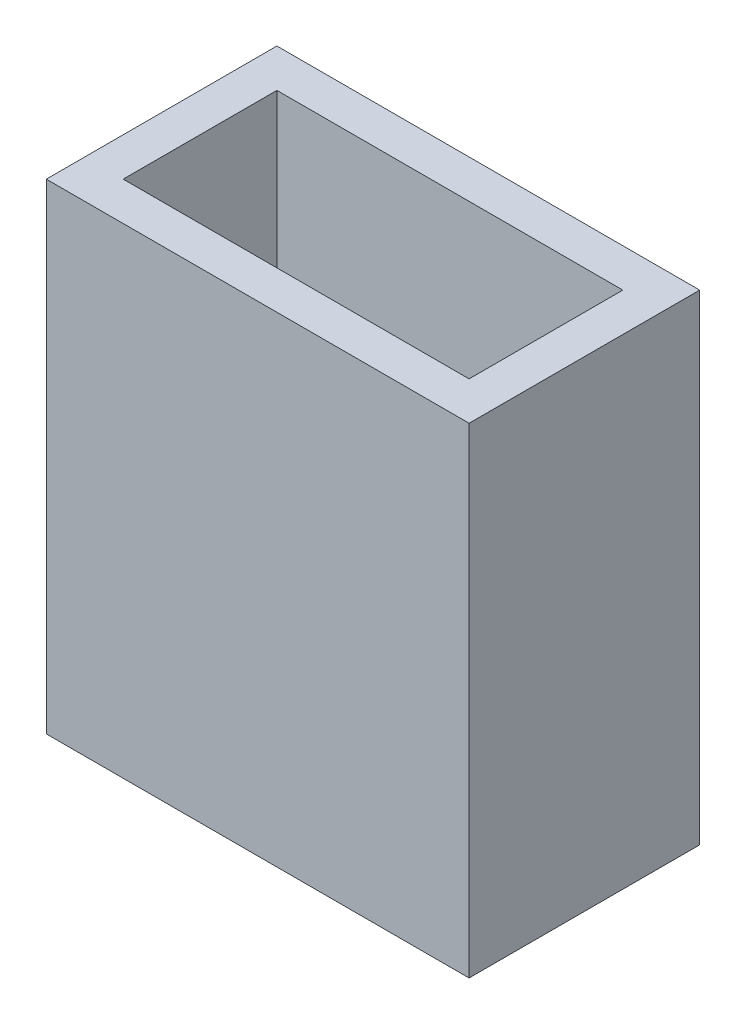
from build123d import *

# Parameters (mm, degrees)
SKETCH1_W           = 22
SKETCH1_H           = 25
BOSS_EXTRUDE1_DEPTH = 12
SKETCH2_W           = 18
SKETCH2_H           = 8
CUT_EXTRUDE1_DEPTH  = 25


with BuildPart() as part:
    # Sketch1 → Boss-Extrude1 (new body)
    with BuildSketch(Plane.XY):
        with Locations((11, 12.5)):
            Rectangle(SKETCH1_W, SKETCH1_H)
    extrude(amount=BOSS_EXTRUDE1_DEPTH)

    # Sketch2 → Cut-Extrude1 (cut)
    with BuildSketch(Plane(origin=(0, 25, 0), x_dir=(1, 0, 0), z_dir=(0, 1, 0))):
        with Locations((11, -6)):
            Rectangle(SKETCH2_W, SKETCH2_H)
    extrude(amount=-CUT_EXTRUDE1_DEPTH, mode=Mode.SUBTRACT)


solid = part.part
